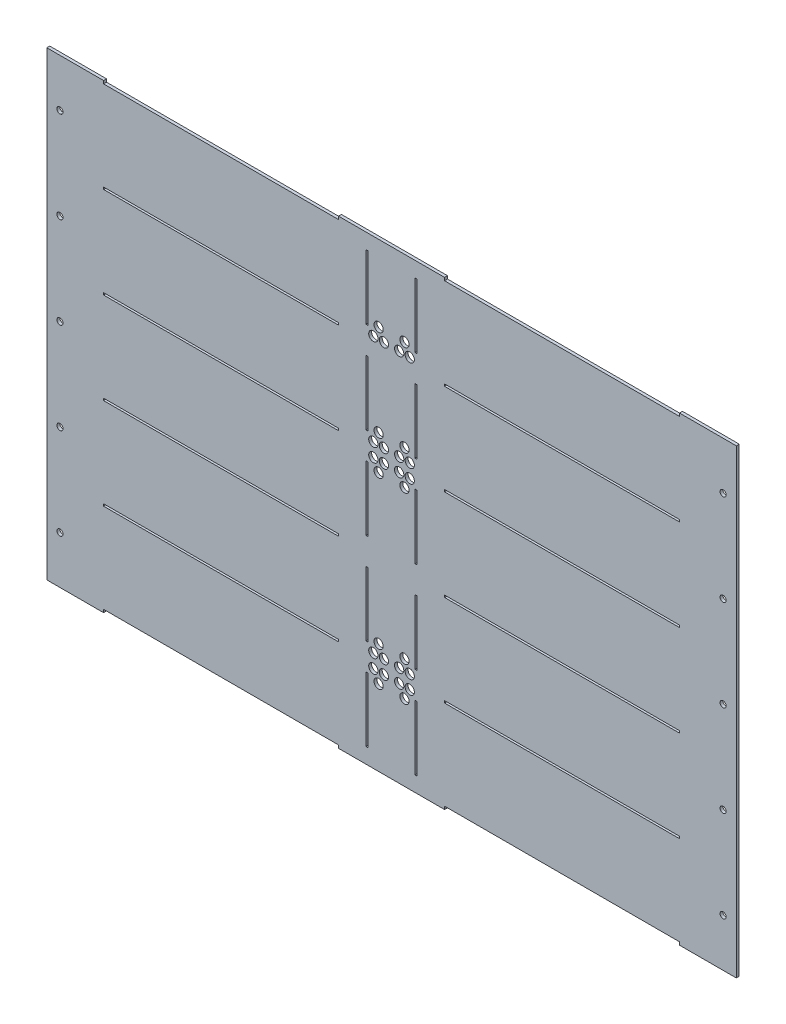
from build123d import *

# Parameters (mm, degrees)
MASTER_SKETCH_W           = 688.4416
MASTER_SKETCH_H           = 498.348
BOSS_EXTRUDE1_DEPTH       = 3.175
SKETCH1_W                 = 28.575
SKETCH1_H                 = 498.348
BOSS_EXTRUDE2_DEPTH       = 3.175
M6_CLEARANCE_HOLE1_D      = 6.6
SKETCH5_W                 = 2.286
SKETCH5_H                 = 69.85
CUT_EXTRUDE1_DEPTH        = 449.413281916
LPATTERN1_COUNT           = 5
LPATTERN1_PITCH           = 98.8568
SKETCH6_W                 = 254
SKETCH6_H                 = 3.175
CUT_EXTRUDE2_DEPTH        = 449.413281916
SKETCH7_W                 = 254
SKETCH7_H                 = 2.286
CUT_EXTRUDE3_DEPTH        = 449.413281916
LPATTERN2_COUNT           = 4
LPATTERN2_PITCH           = 98.8568
SKETCH8_R                 = 5
CUT_EXTRUDE4_DEPTH        = 449.413281916
LPATTERN3_COUNT           = 2
LPATTERN3_PITCH           = 197.7136
LPATTERN3_COPY_1_SKETCH_R = 5
LPATTERN3_COPY_1_DEPTH    = 449.413281916
SKETCH9_R                 = 5
CUT_EXTRUDE5_DEPTH        = 449.413281916
LPATTERN4_COUNT           = 4
LPATTERN4_PITCH           = 98.8568
LPATTERN4_COPY_1_SKETCH_R = 5
LPATTERN4_COPY_1_DEPTH    = 449.413281916
LPATTERN4_COPY_2_SKETCH_R = 5
LPATTERN4_COPY_2_DEPTH    = 449.413281916


with BuildPart() as part:
    # Master Sketch → Boss-Extrude1 (new body)
    with BuildSketch(Plane.XY):
        Rectangle(MASTER_SKETCH_W, MASTER_SKETCH_H)
    extrude(amount=BOSS_EXTRUDE1_DEPTH)

    # Sketch1 → Boss-Extrude2 (add)
    with BuildSketch(Plane.XY.offset(3.175)):
        with Locations((-358.5083, 0)):
            Rectangle(SKETCH1_W, SKETCH1_H)
    boss_extrude2 = extrude(amount=-BOSS_EXTRUDE2_DEPTH)

    # M6 Clearance Hole1 (through all)
    with Locations(Plane.XY.offset(3.175)):
        with Locations((-358.5083, -197.612), (-358.5083, -98.806), (-358.5083, 0), (-358.5083, 98.806), (-358.5083, 197.612)):
            m6_clearance_hole1 = Hole(M6_CLEARANCE_HOLE1_D / 2)

    # Mirror1: Boss-Extrude2, M6 Clearance Hole1 across plane
    add(boss_extrude2.mirror(Plane(origin=(0, 0, 0), x_dir=(0, 0, 1), z_dir=(1, 0, 0))))
    add(m6_clearance_hole1.mirror(Plane(origin=(0, 0, 0), x_dir=(0, 0, 1), z_dir=(1, 0, 0))), mode=Mode.SUBTRACT)

    # Sketch5 → Cut-Extrude1 (cut, through all)
    with BuildSketch(Plane.XY.offset(3.175)):
        with Locations((26.543, 197.7136)):
            Rectangle(SKETCH5_W, SKETCH5_H)
        with Locations((-26.543, 197.7136)):
            Rectangle(SKETCH5_W, SKETCH5_H)
    cut_extrude1 = extrude(amount=-CUT_EXTRUDE1_DEPTH, mode=Mode.SUBTRACT)

    # LPattern1: Cut-Extrude1 ×5
    with Locations(*[(0, -i * LPATTERN1_PITCH, 0) for i in range(1, LPATTERN1_COUNT)]):
        add(cut_extrude1, mode=Mode.SUBTRACT)

    # Sketch6 → Cut-Extrude2 (cut, through all)
    with BuildSketch(Plane.XY.offset(3.175)):
        with Locations((-184.3659, 247.5865)):
            Rectangle(SKETCH6_W, SKETCH6_H)
        with Locations((184.3659, 247.5865)):
            Rectangle(SKETCH6_W, SKETCH6_H)
    cut_extrude2 = extrude(amount=-CUT_EXTRUDE2_DEPTH, mode=Mode.SUBTRACT)

    # Mirror2: Cut-Extrude2 across plane
    add(cut_extrude2.mirror(Plane.ZX), mode=Mode.SUBTRACT)

    # Sketch7 → Cut-Extrude3 (cut, through all)
    with BuildSketch(Plane.XY.offset(3.175)):
        with Locations((-184.3659, 148.2852)):
            Rectangle(SKETCH7_W, SKETCH7_H)
        with Locations((184.3659, 148.2852)):
            Rectangle(SKETCH7_W, SKETCH7_H)
    cut_extrude3 = extrude(amount=-CUT_EXTRUDE3_DEPTH, mode=Mode.SUBTRACT)

    # LPattern2: Cut-Extrude3 ×4
    with Locations(*[(0, -i * LPATTERN2_PITCH, 0) for i in range(1, LPATTERN2_COUNT)]):
        add(cut_extrude3, mode=Mode.SUBTRACT)

    # Sketch8 → Cut-Extrude4 (cut, through all)
    with BuildSketch(Plane(origin=(0, 0, 0), x_dir=(-1, 0, 0), z_dir=(0, 0, -1))):
        with Locations((8.255, -155.591933333)):
            Circle(SKETCH8_R)
        with Locations((19.685, -155.591933333)):
            Circle(SKETCH8_R)
        with Locations((13.97, -167.021933333)):
            Circle(SKETCH8_R)
    cut_extrude4 = extrude(amount=-CUT_EXTRUDE4_DEPTH, mode=Mode.SUBTRACT)

    # Mirror3: Cut-Extrude4 across plane
    add(cut_extrude4.mirror(Plane(origin=(0, 0, 0), x_dir=(0, 0, 1), z_dir=(1, 0, 0))), mode=Mode.SUBTRACT)

    # LPattern3: Cut-Extrude4 ×2
    with Locations(*[(0, i * LPATTERN3_PITCH, 0) for i in range(1, LPATTERN3_COUNT)]):
        add(cut_extrude4, mode=Mode.SUBTRACT)

    # LPattern3 copy 1 sketch → LPattern3 copy 1 (cut, through all)
    with BuildSketch(Plane(origin=(0, 197.7136, 0), x_dir=(1, 0, 0), z_dir=(0, 0, -1))):
        with Locations((8.255, 155.591933333)):
            Circle(LPATTERN3_COPY_1_SKETCH_R)
        with Locations((19.685, 155.591933333)):
            Circle(LPATTERN3_COPY_1_SKETCH_R)
        with Locations((13.97, 167.021933333)):
            Circle(LPATTERN3_COPY_1_SKETCH_R)
    extrude(amount=-LPATTERN3_COPY_1_DEPTH, mode=Mode.SUBTRACT)

    # Sketch9 → Cut-Extrude5 (cut, through all)
    with BuildSketch(Plane(origin=(0, 0, 0), x_dir=(-1, 0, 0), z_dir=(0, 0, -1))):
        with Locations((8.255, -140.978466667)):
            Circle(SKETCH9_R)
        with Locations((13.97, -129.548466667)):
            Circle(SKETCH9_R)
        with Locations((19.685, -140.978466667)):
            Circle(SKETCH9_R)
    cut_extrude5 = extrude(amount=-CUT_EXTRUDE5_DEPTH, mode=Mode.SUBTRACT)

    # Mirror4: Cut-Extrude5 across plane
    add(cut_extrude5.mirror(Plane(origin=(0, 0, 0), x_dir=(0, 0, 1), z_dir=(1, 0, 0))), mode=Mode.SUBTRACT)

    # LPattern4: Cut-Extrude5 ×4, 1 skipped
    with Locations(*[(0, i * LPATTERN4_PITCH, 0) for i in range(1, LPATTERN4_COUNT) if i not in (1,)]):
        add(cut_extrude5, mode=Mode.SUBTRACT)

    # LPattern4 copy 1 sketch → LPattern4 copy 1 (cut, through all)
    with BuildSketch(Plane(origin=(0, 197.7136, 0), x_dir=(1, 0, 0), z_dir=(0, 0, -1))):
        with Locations((8.255, 140.978466667)):
            Circle(LPATTERN4_COPY_1_SKETCH_R)
        with Locations((13.97, 129.548466667)):
            Circle(LPATTERN4_COPY_1_SKETCH_R)
        with Locations((19.685, 140.978466667)):
            Circle(LPATTERN4_COPY_1_SKETCH_R)
    extrude(amount=-LPATTERN4_COPY_1_DEPTH, mode=Mode.SUBTRACT)

    # LPattern4 copy 2 sketch → LPattern4 copy 2 (cut, through all)
    with BuildSketch(Plane(origin=(0, 296.5704, 0), x_dir=(1, 0, 0), z_dir=(0, 0, -1))):
        with Locations((8.255, 140.978466667)):
            Circle(LPATTERN4_COPY_2_SKETCH_R)
        with Locations((13.97, 129.548466667)):
            Circle(LPATTERN4_COPY_2_SKETCH_R)
        with Locations((19.685, 140.978466667)):
            Circle(LPATTERN4_COPY_2_SKETCH_R)
    extrude(amount=-LPATTERN4_COPY_2_DEPTH, mode=Mode.SUBTRACT)


solid = part.part
